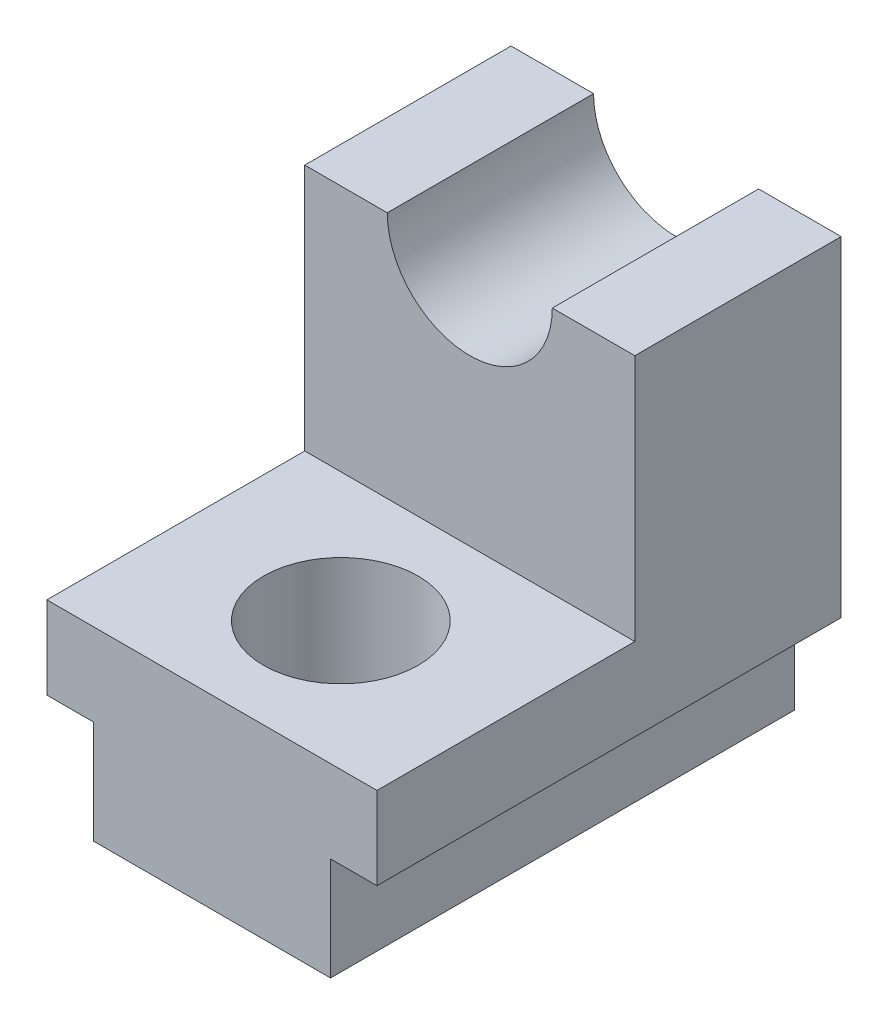
from build123d import *

# Parameters (mm, degrees)
EXTRUDE_1_DEPTH     = 45
SKETCH_2_R          = 7.5
CUT_EXTRUDE_2_DEPTH = 24
SKETCH_3_W          = 32
SKETCH_3_H          = 20
EXTRUDE_4_DEPTH     = 24
SKETCH_4_R          = 8
CUT_EXTRUDE_3_DEPTH = 24


with BuildPart() as part:
    # 草图1 → 凸台-拉伸1 (new body)
    with BuildSketch(Plane.XY):
        Polygon((-11.5, -5), (11.5, -5), (11.5, 5), (16, 5), (16, 13), (-16, 13), (-16, 5), (-11.5, 5), align=None)
    extrude(amount=-EXTRUDE_1_DEPTH)

    # 草图2 → 切除-拉伸2 (cut)
    with BuildSketch(Plane(origin=(0, 13, 0), x_dir=(1, 0, 0), z_dir=(0, 1, 0))):
        with Locations(Location((0, 12.5, 0), (0, 0, 270))):
            Circle(SKETCH_2_R)
    extrude(amount=-CUT_EXTRUDE_2_DEPTH, mode=Mode.SUBTRACT)

    # 草图3 → 凸台-拉伸4 (add)
    with BuildSketch(Plane(origin=(0, 13, 0), x_dir=(1, 0, 0), z_dir=(0, 1, 0))):
        with Locations((0, 35)):
            Rectangle(SKETCH_3_W, SKETCH_3_H)
    extrude(amount=EXTRUDE_4_DEPTH)

    # 草图4 → 切除-拉伸3 (cut)
    with BuildSketch(Plane.XY.offset(-25)):
        with Locations((0, 37)):
            Circle(SKETCH_4_R)
    extrude(amount=-CUT_EXTRUDE_3_DEPTH, mode=Mode.SUBTRACT)


solid = part.part
